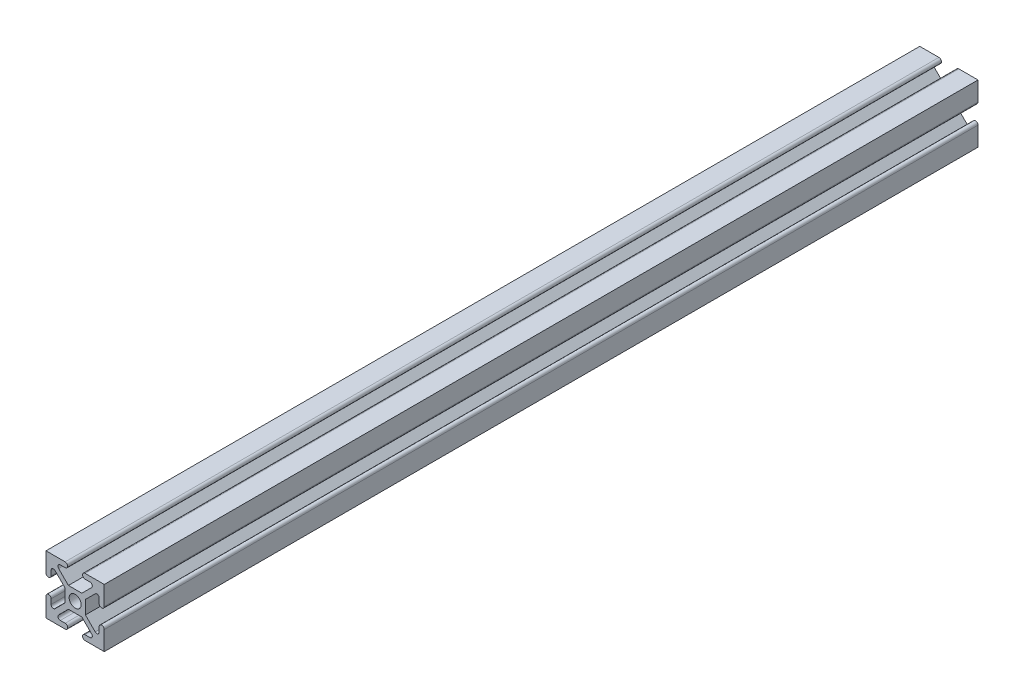
from build123d import *

# Parameters (mm, degrees)
SKETCH1_R           = 2.6035
BOSS_EXTRUDE1_DEPTH = 381


with BuildPart() as part:
    # Sketch1 → Boss-Extrude1 (new body)
    with BuildSketch(Plane.XY):
        with BuildLine():
            Line((-12.7, -12.7), (-4.343399971, -12.7))
            ThreePointArc((-4.343399971, -12.7), (-3.238499971, -11.5951), (-4.343399971, -10.4902))
            Line((-4.343399971, -10.4902), (-6.474794456, -10.4902))
            ThreePointArc((-6.474794456, -10.4902), (-7.413456061, -9.863006367), (-7.193214945, -8.75577951))
            Line((-7.193214945, -8.75577951), (-2.933235435, -4.4958))
            Line((-2.933235435, -4.4958), (2.933235435, -4.4958))
            Line((2.933235435, -4.4958), (7.193214945, -8.75577951))
            ThreePointArc((7.193214945, -8.75577951), (7.413456061, -9.863006367), (6.474794456, -10.4902))
            Line((6.474794456, -10.4902), (4.3434, -10.4902))
            ThreePointArc((4.3434, -10.4902), (3.2385, -11.5951), (4.3434, -12.7))
            Line((4.3434, -12.7), (12.7, -12.7))
            Line((12.7, -12.7), (12.7, -4.343399971))
            ThreePointArc((12.7, -4.343399971), (11.5951, -3.238499971), (10.4902, -4.343399971))
            Line((10.4902, -4.343399971), (10.4902, -6.474794456))
            ThreePointArc((10.4902, -6.474794456), (9.863006367, -7.413456061), (8.75577951, -7.193214945))
            Line((8.75577951, -7.193214945), (4.4958, -2.933235435))
            Line((4.4958, -2.933235435), (4.4958, 2.933235435))
            Line((4.4958, 2.933235435), (8.75577951, 7.193214945))
            ThreePointArc((8.75577951, 7.193214945), (9.863006367, 7.413456061), (10.4902, 6.474794456))
            Line((10.4902, 6.474794456), (10.4902, 4.3434))
            ThreePointArc((10.4902, 4.3434), (11.5951, 3.2385), (12.7, 4.3434))
            Line((12.7, 4.3434), (12.7, 12.7))
            Line((12.7, 12.7), (4.343399971, 12.7))
            ThreePointArc((4.343399971, 12.7), (3.238499971, 11.5951), (4.343399971, 10.4902))
            Line((4.343399971, 10.4902), (6.474794456, 10.4902))
            ThreePointArc((6.474794456, 10.4902), (7.413456061, 9.863006367), (7.193214945, 8.75577951))
            Line((7.193214945, 8.75577951), (2.933235435, 4.4958))
            Line((2.933235435, 4.4958), (-2.933235435, 4.4958))
            Line((-2.933235435, 4.4958), (-7.193214945, 8.75577951))
            ThreePointArc((-7.193214945, 8.75577951), (-7.413456061, 9.863006367), (-6.474794456, 10.4902))
            Line((-6.474794456, 10.4902), (-4.3434, 10.4902))
            ThreePointArc((-4.3434, 10.4902), (-3.2385, 11.5951), (-4.3434, 12.7))
            Line((-4.3434, 12.7), (-12.7, 12.7))
            Line((-12.7, 12.7), (-12.7, 4.343399971))
            ThreePointArc((-12.7, 4.343399971), (-11.5951, 3.238499971), (-10.4902, 4.343399971))
            Line((-10.4902, 4.343399971), (-10.4902, 6.474794456))
            ThreePointArc((-10.4902, 6.474794456), (-9.863006367, 7.413456061), (-8.75577951, 7.193214945))
            Line((-8.75577951, 7.193214945), (-4.4958, 2.933235435))
            Line((-4.4958, 2.933235435), (-4.4958, -2.933235435))
            Line((-4.4958, -2.933235435), (-8.75577951, -7.193214945))
            ThreePointArc((-8.75577951, -7.193214945), (-9.863006367, -7.413456061), (-10.4902, -6.474794456))
            Line((-10.4902, -6.474794456), (-10.4902, -4.3434))
            ThreePointArc((-10.4902, -4.3434), (-11.5951, -3.2385), (-12.7, -4.3434))
            Line((-12.7, -4.3434), (-12.7, -12.7))
        make_face()
        with Locations(Location((0, 0, 0), (0, 0, 180))):
            Circle(SKETCH1_R, mode=Mode.SUBTRACT)
    extrude(amount=-BOSS_EXTRUDE1_DEPTH)


solid = part.part
